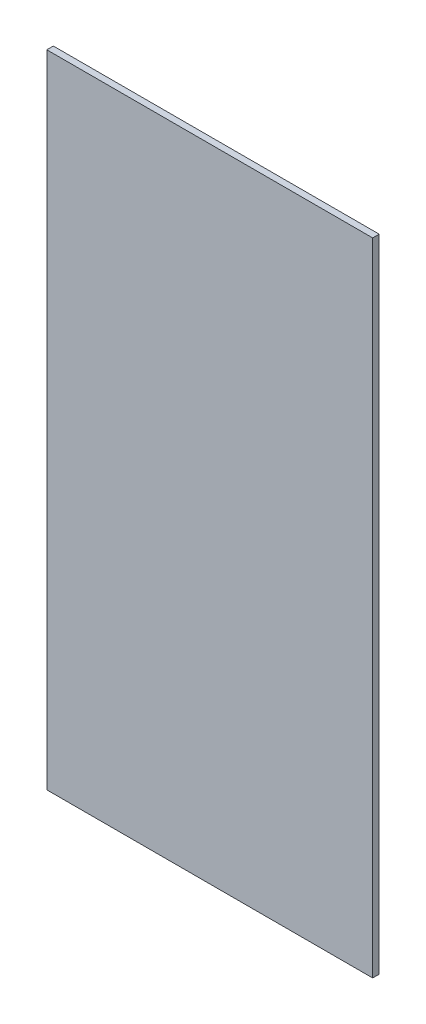
from build123d import *

# Parameters (mm, degrees)
SKETCH1_W           = 150
SKETCH1_H           = 295
BOSS_EXTRUDE1_DEPTH = 3


with BuildPart() as part:
    # Sketch1 → Boss-Extrude1 (new body)
    with BuildSketch(Plane.XY):
        Rectangle(SKETCH1_W, SKETCH1_H)
    extrude(amount=BOSS_EXTRUDE1_DEPTH)


solid = part.part
